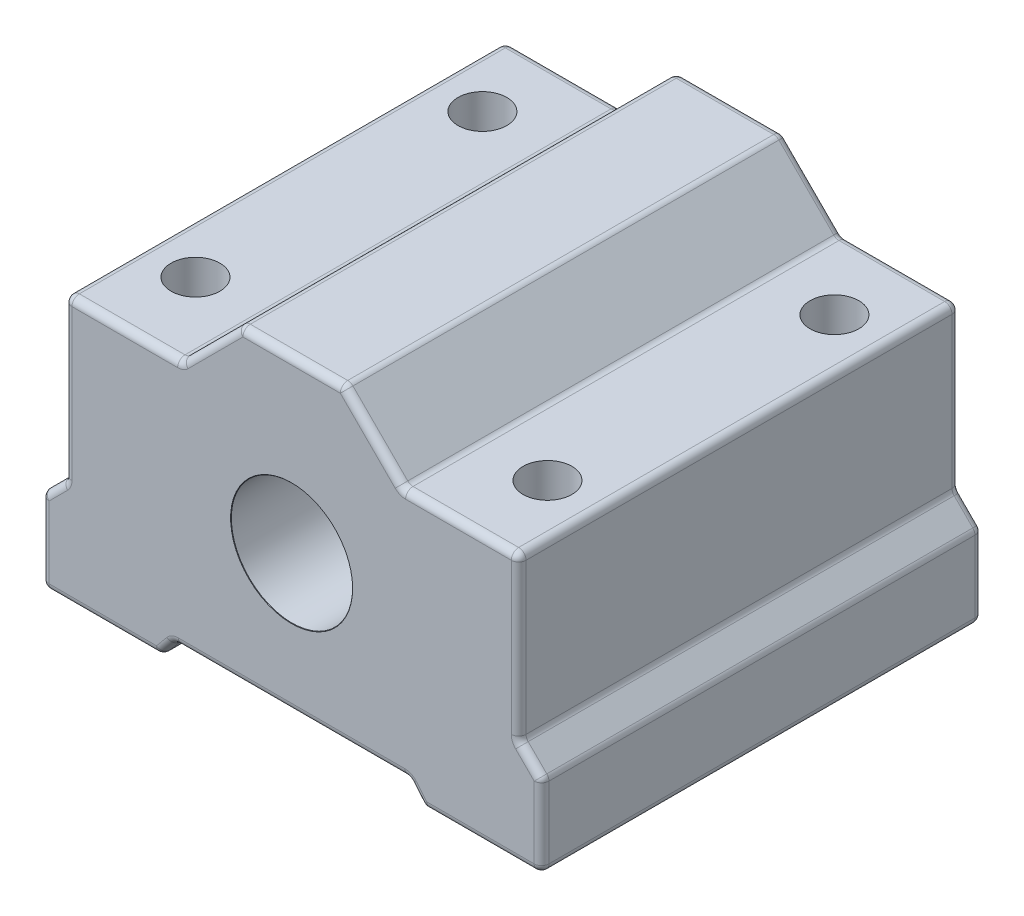
from build123d import *

# Parameters (mm, degrees)
BOSS_EXTRUDE1_DEPTH                  = 29.8
FILLET1_R                            = 0.5
F_8_2_8_2_DIAMETER_HOLE1_D           = 8.2
F_8_2_8_2_DIAMETER_HOLE1_CSINK_D     = 8.25
F_8_2_8_2_DIAMETER_HOLE1_CSINK_ANGLE = 90
M4_TAPPED_HOLE1_D                    = 3.3
M4_TAPPED_HOLE1_CSINK_D              = 4.05
M4_TAPPED_HOLE1_CSINK_ANGLE          = 90


with BuildPart() as part:
    # Sketch1 → Boss-Extrude1 (new body)
    with BuildSketch(Plane.XY):
        Polygon((-3.5, 4), (3.5, 4), (7.5, 0), (15.35, 0), (15.35, -10.9), (16.9, -12.45), (16.9, -18), (8.9, -18), (7.9, -16.8), (-7.9, -16.8), (-8.9, -18), (-16.9, -18), (-16.9, -12.45), (-15.35, -10.9), (-15.35, 0), (-7.5, 0), align=None)
    extrude(amount=BOSS_EXTRUDE1_DEPTH)

    # Fillet1
    fillet1_edges = [part.edges().sort_by_distance(p)[0] for p in [
        (-5.5, 2, 29.8),
        (11.425, 0, 0),
        (15.35, -5.45, 0),
        (16.125, -11.675, 0),
        (-11.425, 0, 29.8),
        (16.9, -15.225, 0),
        (12.9, -18, 0),
        (8.4, -17.4, 0),
        (0, -16.8, 0),
        (-8.4, -17.4, 0),
        (-12.9, -18, 0),
        (-16.9, -15.225, 0),
        (-16.125, -11.675, 0),
        (-15.35, -5.45, 0),
        (-11.425, 0, 0),
        (-15.35, -5.45, 29.8),
        (-5.5, 2, 0),
        (0, 4, 0),
        (5.5, 2, 0),
        (-16.125, -11.675, 29.8),
        (7.5, 0, 14.9),
        (15.35, 0, 14.9),
        (15.35, -10.9, 14.9),
        (16.9, -12.45, 14.9),
        (16.9, -18, 14.9),
        (8.9, -18, 14.9),
        (7.9, -16.8, 14.9),
        (-7.9, -16.8, 14.9),
        (-8.9, -18, 14.9),
        (-16.9, -18, 14.9),
        (-16.9, -12.45, 14.9),
        (-15.35, -10.9, 14.9),
        (-15.35, 0, 14.9),
        (-7.5, 0, 14.9),
        (-3.5, 4, 14.9),
        (3.5, 4, 14.9),
        (-16.9, -15.225, 29.8),
        (-12.9, -18, 29.8),
        (-8.4, -17.4, 29.8),
        (0, -16.8, 29.8),
        (8.4, -17.4, 29.8),
        (12.9, -18, 29.8),
        (5.5, 2, 29.8),
        (16.9, -15.225, 29.8),
        (16.125, -11.675, 29.8),
        (15.35, -5.45, 29.8),
        (11.425, 0, 29.8),
        (0, 4, 29.8),
    ]]
    fillet(fillet1_edges, radius=FILLET1_R)

    # Ø8.2 (8.2) Diameter Hole1 (through all)
    with Locations(Plane(origin=(0, -7.513450587, 29.8), x_dir=(1, 0, 0), z_dir=(0, 0, 1))):
        with Locations((0, 0)):
            CounterSinkHole(F_8_2_8_2_DIAMETER_HOLE1_D / 2, F_8_2_8_2_DIAMETER_HOLE1_CSINK_D / 2, counter_sink_angle=F_8_2_8_2_DIAMETER_HOLE1_CSINK_ANGLE)

    # M4 Tapped Hole1 (through all)
    with Locations(Plane(origin=(11.9, -18, 24.4), x_dir=(0, 0, -1), z_dir=(0, -1, 0))):
        with Locations((0, 0), (19.4, 0), (19.4, -23.8), (0, -23.8)):
            CounterSinkHole(M4_TAPPED_HOLE1_D / 2, M4_TAPPED_HOLE1_CSINK_D / 2, counter_sink_angle=M4_TAPPED_HOLE1_CSINK_ANGLE)


solid = part.part
